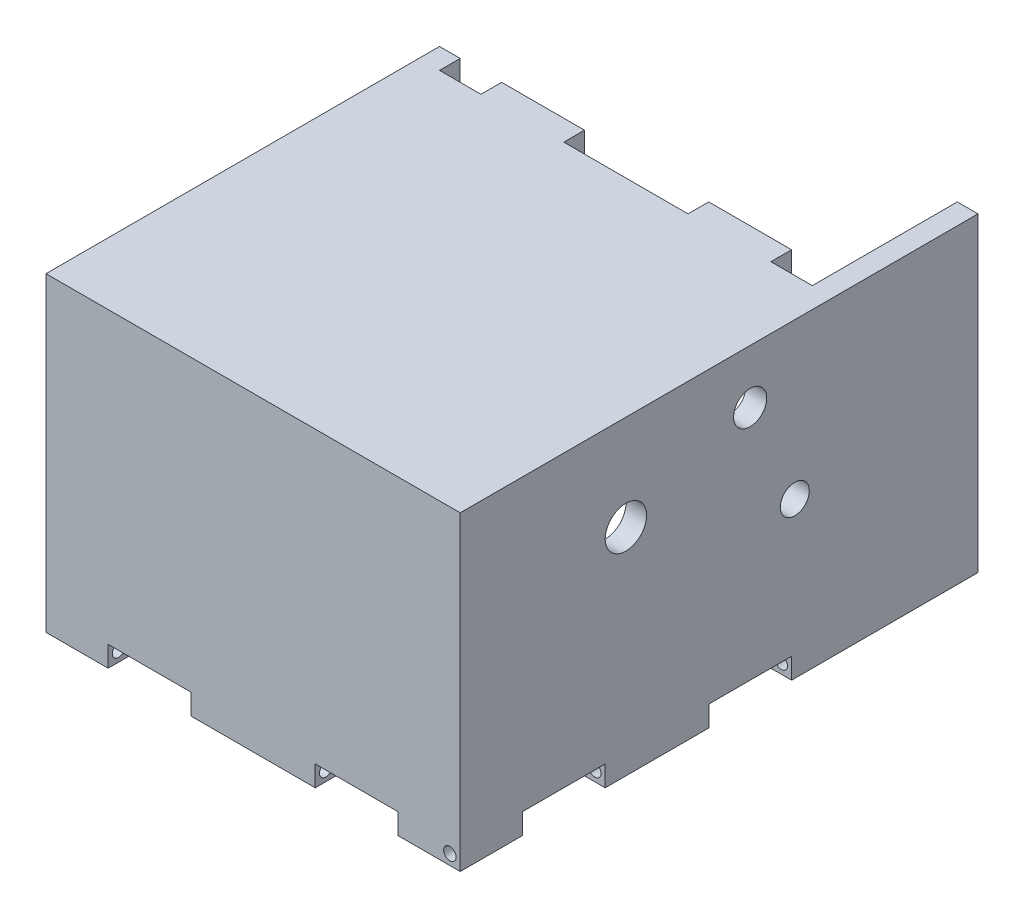
from build123d import *

# Parameters (mm, degrees)
VOLUME_BOITIER_DEPTH     = 90
ESQUISSE2_W              = 100
ESQUISSE2_H              = 75
FACE_INF_RIEURE_DEPTH    = 5
ESQUISSE3_W              = 5
ESQUISSE3_H              = 75
FACE_PILE_DEPTH          = 30
ESQUISSE7_W              = 5
ESQUISSE7_H              = 20
ESQUISSE7_W_2            = 20
ESQUISSE7_H_2            = 5
ENL_V_MAT_EXTRU_2_DEPTH  = 5
ESQUISSE8_R              = 1.5
ENL_V_MAT_EXTRU_3_DEPTH  = 93
ESQUISSE9_R              = 1.5
ENL_V_MAT_EXTRU_4_DEPTH  = 88
ESQUISSE10_R             = 1.5
ENL_V_MAT_EXTRU_5_DEPTH  = 87
ENL_V_MAT_EXTRU_6_REACH  = 159.003
ESQUISSE11_R             = 3.5
ESQUISSE14_W             = 10
ESQUISSE14_H             = 5
ESQUISSE14_W_2           = 30
ENL_V_MAT_EXTRU_8_DEPTH  = 5
BOSS_EXTRU_7_DEPTH       = 85
ENL_V_MAT_EXTRU_10_REACH = 151.245
ESQUISSE15_W             = 15
ESQUISSE15_H             = 12
ENL_V_MAT_EXTRU_11_REACH = 159.003
ESQUISSE16_R             = 4
ESQUISSE16_R_2           = 5
ENL_V_MAT_EXTRU_12_DEPTH = 25


with BuildPart() as part:
    # Esquisse1 → volume boitier (new body)
    with BuildSketch(Plane.XY):
        Polygon((0, 75), (0, 0), (5, 0), (5, 70), (95, 70), (95, 0), (100, 0), (100, 75), align=None)
    extrude(amount=VOLUME_BOITIER_DEPTH)

    # Esquisse2 → face inférieure (add)
    with BuildSketch(Plane.XY.offset(90)):
        with Locations((50, 37.5)):
            Rectangle(ESQUISSE2_W, ESQUISSE2_H)
    extrude(amount=FACE_INF_RIEURE_DEPTH)

    # Esquisse3 → face pile (add)
    with BuildSketch(Plane(origin=(0, 0, 0), x_dir=(-1, 0, 0), z_dir=(0, 0, -1))):
        with Locations((-97.5, 37.5)):
            Rectangle(ESQUISSE3_W, ESQUISSE3_H)
    extrude(amount=FACE_PILE_DEPTH)

    # Esquisse7 → Enlèv. mat.-Extru.2 (cut)
    with BuildSketch(Plane.XZ):
        with Locations((2.5, 25)):
            Rectangle(ESQUISSE7_W, ESQUISSE7_H)
        with Locations((2.5, 70)):
            Rectangle(ESQUISSE7_W, ESQUISSE7_H)
        with Locations((25, 92.5)):
            Rectangle(ESQUISSE7_W_2, ESQUISSE7_H_2)
        with Locations((75, 92.5)):
            Rectangle(ESQUISSE7_W_2, ESQUISSE7_H_2)
        with Locations((97.5, 70)):
            Rectangle(ESQUISSE7_W, ESQUISSE7_H)
        with Locations((97.5, 25)):
            Rectangle(ESQUISSE7_W, ESQUISSE7_H)
    extrude(amount=-ENL_V_MAT_EXTRU_2_DEPTH, mode=Mode.SUBTRACT)

    # Esquisse8 → Enlèv. mat.-Extru.3 (cut)
    with BuildSketch(Plane.ZY):
        with Locations((92.5, 2.5)):
            Circle(ESQUISSE8_R)
    extrude(amount=-ENL_V_MAT_EXTRU_3_DEPTH, mode=Mode.SUBTRACT)

    # Esquisse9 → Enlèv. mat.-Extru.4 (cut)
    with BuildSketch(Plane(origin=(0, 0, 0), x_dir=(-1, 0, 0), z_dir=(0, 0, -1))):
        with Locations((-2.5, 2.5)):
            Circle(ESQUISSE9_R)
    extrude(amount=-ENL_V_MAT_EXTRU_4_DEPTH, mode=Mode.SUBTRACT)

    # Esquisse10 → Enlèv. mat.-Extru.5 (cut)
    with BuildSketch(Plane.XY.offset(95)):
        with Locations(Location((97.5, 2.5, 0), (0, 0, 180))):
            Circle(ESQUISSE10_R)
    extrude(amount=-ENL_V_MAT_EXTRU_5_DEPTH, mode=Mode.SUBTRACT)

    # Esquisse11 → Enlèv. mat.-Extru.6 (cut, up to next)
    with BuildSketch(Plane(origin=(100, 0, 0), x_dir=(0, 0, -1), z_dir=(1, 0, 0)), mode=Mode.PRIVATE) as enl_v_mat_extru_6_sk1:
        with Locations((-14.229443479, 37.5)):
            Circle(ESQUISSE11_R)
    enl_v_mat_extru_6_tool1 = extrude(enl_v_mat_extru_6_sk1.sketch, amount=-ENL_V_MAT_EXTRU_6_REACH, mode=Mode.PRIVATE) & part.part
    add(enl_v_mat_extru_6_tool1.solids().sort_by_distance((100, 37.5, 14.229443))[0], mode=Mode.SUBTRACT)

    # Esquisse14 → Enlèv. mat.-Extru.8 (cut)
    with BuildSketch(Plane(origin=(0, 0, 0), x_dir=(-1, 0, 0), z_dir=(0, 0, -1))):
        with Locations((-90, 72.5)):
            Rectangle(ESQUISSE14_W, ESQUISSE14_H)
        with Locations((-50, 72.5)):
            Rectangle(ESQUISSE14_W_2, ESQUISSE14_H)
        with Locations((-10, 72.5)):
            Rectangle(ESQUISSE14_W, ESQUISSE14_H)
    extrude(amount=-ENL_V_MAT_EXTRU_8_DEPTH, mode=Mode.SUBTRACT)

    # Esquisse12 → Boss.-Extru.7 (add)
    with BuildSketch(Plane(origin=(0, 0, 90), x_dir=(-1, 0, 0), z_dir=(0, 0, -1))):
        Polygon((-37, 46), (-70.75, 46), (-70.75, 38), (-69.25, 38), (-69.25, 44), (-5, 44), (-5, 49), (-32, 49), (-32, 70), (-37, 70), align=None)
        Polygon((-52, 16.786904399), (-52, 12), (-53.5, 12), (-53.5, 18), (-95, 18), (-95, 20), (-52, 20), align=None)
    extrude(amount=BOSS_EXTRU_7_DEPTH)

    # Esquisse15 → Enlèv. mat.-Extru.10 (cut, up to next)
    with BuildSketch(Plane.XZ.offset(-18), mode=Mode.PRIVATE) as enl_v_mat_extru_10_sk1:
        with Locations((75, 84)):
            Rectangle(ESQUISSE15_W, ESQUISSE15_H)
    enl_v_mat_extru_10_tool1 = extrude(enl_v_mat_extru_10_sk1.sketch, amount=-ENL_V_MAT_EXTRU_10_REACH, mode=Mode.PRIVATE) & part.part
    add(enl_v_mat_extru_10_tool1.solids().sort_by_distance((75, 18, 84))[0], mode=Mode.SUBTRACT)

    # Esquisse16 → Enlèv. mat.-Extru.11 (cut, up to next)
    with BuildSketch(Plane(origin=(100, 0, 0), x_dir=(0, 0, -1), z_dir=(1, 0, 0)), mode=Mode.PRIVATE) as enl_v_mat_extru_11_sk1:
        with Locations((-25, 62)):
            Circle(ESQUISSE16_R)
    enl_v_mat_extru_11_tool1 = extrude(enl_v_mat_extru_11_sk1.sketch, amount=-ENL_V_MAT_EXTRU_11_REACH, mode=Mode.PRIVATE) & part.part
    # Esquisse16 → Enlèv. mat.-Extru.11 (cut, up to next)
    with BuildSketch(Plane(origin=(100, 0, 0), x_dir=(0, 0, -1), z_dir=(1, 0, 0)), mode=Mode.PRIVATE) as enl_v_mat_extru_11_sk2:
        with Locations((-55, 52)):
            Circle(ESQUISSE16_R_2)
    enl_v_mat_extru_11_tool2 = extrude(enl_v_mat_extru_11_sk2.sketch, amount=-ENL_V_MAT_EXTRU_11_REACH, mode=Mode.PRIVATE) & part.part
    add(enl_v_mat_extru_11_tool1.solids().sort_by_distance((100, 62, 25))[0], mode=Mode.SUBTRACT)
    add(enl_v_mat_extru_11_tool2.solids().sort_by_distance((100, 52, 55))[0], mode=Mode.SUBTRACT)

    # Esquisse17 → Enlèv. mat.-Extru.12 (cut)
    with BuildSketch(Plane(origin=(0, 0, 5), x_dir=(-1, 0, 0), z_dir=(0, 0, -1))):
        Polygon((-88.283089538, 20), (-52, 20), (-52, 12), (-53.5, 12), (-53.5, 18), (-88.283089538, 18), align=None)
    extrude(amount=-ENL_V_MAT_EXTRU_12_DEPTH, mode=Mode.SUBTRACT)


solid = part.part
